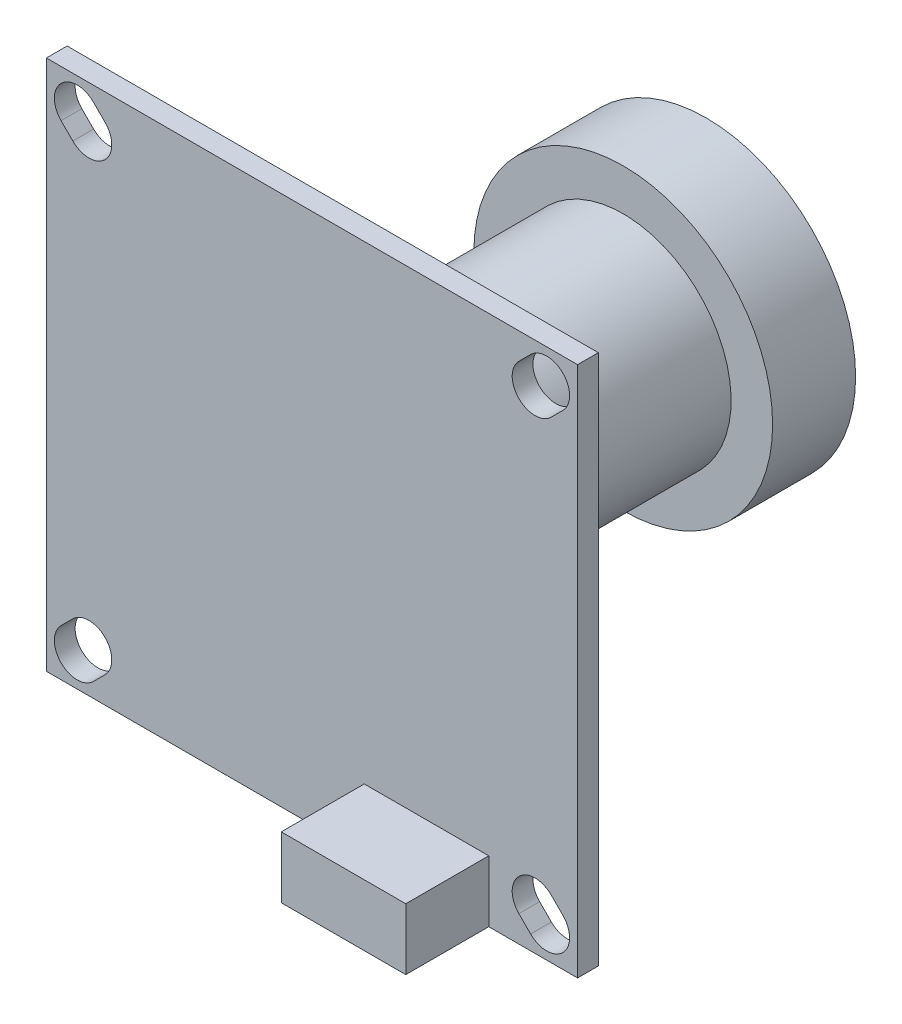
from build123d import *

# Parameters (mm, degrees)
ESQUISSE1_W        = 32
ESQUISSE1_H        = 32
BOSS_EXTRU_1_DEPTH = 1.25
ESQUISSE2_W        = 7.5
ESQUISSE2_H        = 3.7
BOSS_EXTRU_2_DEPTH = 5
BOSS_EXTRU_3_DEPTH = 3.5
ESQUISSE4_R        = 6.5
BOSS_EXTRU_4_DEPTH = 14
ESQUISSE5_R        = 9
BOSS_EXTRU_5_DEPTH = 5


with BuildPart() as part:
    # Esquisse1 → Boss.-Extru.1 (new body)
    with BuildSketch(Plane.XY):
        Rectangle(ESQUISSE1_W, ESQUISSE1_H)
        with BuildLine():
            Line((-13.171572875, 15.116116524), (-12.464466094, 14.409009742))
            ThreePointArc((-12.464466094, 14.409009742), (-12.464466094, 12.464466094), (-14.409009742, 12.464466094))
            Line((-14.409009742, 12.464466094), (-15.116116524, 13.171572875))
            ThreePointArc((-15.116116524, 13.171572875), (-15.116116524, 15.116116524), (-13.171572875, 15.116116524))
        make_face(mode=Mode.SUBTRACT)
        with BuildLine():
            Line((15.116116524, 13.171572875), (14.409009742, 12.464466094))
            ThreePointArc((14.409009742, 12.464466094), (12.464466094, 12.464466094), (12.464466094, 14.409009742))
            Line((12.464466094, 14.409009742), (13.171572875, 15.116116524))
            ThreePointArc((13.171572875, 15.116116524), (15.116116524, 15.116116524), (15.116116524, 13.171572875))
        make_face(mode=Mode.SUBTRACT)
        with BuildLine():
            Line((13.171572875, -15.116116524), (12.464466094, -14.409009742))
            ThreePointArc((12.464466094, -14.409009742), (12.464466094, -12.464466094), (14.409009742, -12.464466094))
            Line((14.409009742, -12.464466094), (15.116116524, -13.171572875))
            ThreePointArc((15.116116524, -13.171572875), (15.116116524, -15.116116524), (13.171572875, -15.116116524))
        make_face(mode=Mode.SUBTRACT)
        with BuildLine():
            Line((-15.116116524, -13.171572875), (-14.409009742, -12.464466094))
            ThreePointArc((-14.409009742, -12.464466094), (-12.464466094, -12.464466094), (-12.464466094, -14.409009742))
            Line((-12.464466094, -14.409009742), (-13.171572875, -15.116116524))
            ThreePointArc((-13.171572875, -15.116116524), (-15.116116524, -15.116116524), (-15.116116524, -13.171572875))
        make_face(mode=Mode.SUBTRACT)
    extrude(amount=BOSS_EXTRU_1_DEPTH)

    # Esquisse2 → Boss.-Extru.2 (add)
    with BuildSketch(Plane.XY.offset(1.25)):
        with Locations((6.9, -14.15)):
            Rectangle(ESQUISSE2_W, ESQUISSE2_H)
    extrude(amount=BOSS_EXTRU_2_DEPTH)

    # Esquisse3 → Boss.-Extru.3 (add)
    with BuildSketch(Plane(origin=(0, 0, 0), x_dir=(-1, 0, 0), z_dir=(0, 0, -1))):
        with BuildLine():
            Line((-6.5, 6.5), (6.5, 6.5))
            Line((6.5, 6.5), (6.5, 2))
            Line((6.5, 2), (8.5, 2))
            ThreePointArc((8.5, 2), (10.5, 0), (8.5, -2))
            Line((8.5, -2), (6.5, -2))
            Line((6.5, -2), (6.5, -6.5))
            Line((6.5, -6.5), (-6.5, -6.5))
            Line((-6.5, -6.5), (-6.5, -2))
            Line((-6.5, -2), (-8.5, -2))
            ThreePointArc((-8.5, -2), (-10.5, 0), (-8.5, 2))
            Line((-8.5, 2), (-6.5, 2))
            Line((-6.5, 2), (-6.5, 6.5))
        make_face()
    extrude(amount=BOSS_EXTRU_3_DEPTH)

    # Esquisse4 → Boss.-Extru.4 (add)
    with BuildSketch(Plane(origin=(0, 0, -3.5), x_dir=(-1, 0, 0), z_dir=(0, 0, -1))):
        with Locations(Location((0, 0, 0), (0, 0, 270))):
            Circle(ESQUISSE4_R)
    extrude(amount=BOSS_EXTRU_4_DEPTH)

    # Esquisse5 → Boss.-Extru.5 (add)
    with BuildSketch(Plane(origin=(0, 0, -17.5), x_dir=(-1, 0, 0), z_dir=(0, 0, -1))):
        Circle(ESQUISSE5_R)
    extrude(amount=BOSS_EXTRU_5_DEPTH)

    # Esquisse6 → Révolution2 (revolve)
    with BuildSketch(Plane(origin=(0, 0, 0), x_dir=(0, 0, -1), z_dir=(1, 0, 0))):
        with BuildLine():
            Line((22.5, 0), (24.5, 0))
            ThreePointArc((24.5, 0), (23.993975029, 4.609772229), (22.5, 9))
            Line((22.5, 9), (22.5, 0))
        make_face()
    revolve(axis=Axis((0, 0, -22.5), (0, 0, -1)))


solid = part.part
